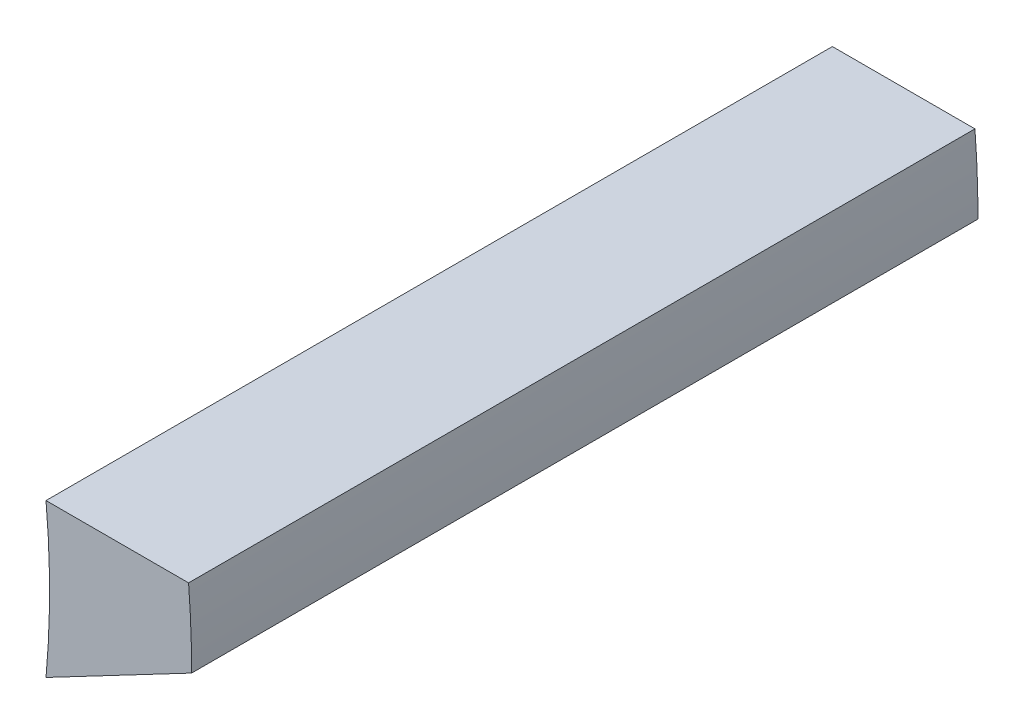
from build123d import *

# Parameters (mm, degrees)
EXTRUDE_1_DEPTH = 18


with BuildPart() as part:
    # 草图1 → 凸台-拉伸1 (new body)
    with BuildSketch(Plane.XY):
        with BuildLine():
            Line((18.711857444, 1.753621629), (21.975643768, 1.753621629))
            ThreePointArc((21.975643768, 1.753621629), (22.028029659, 0.877506244), (22.045500853, 0))
            Line((22.045500853, 0), (18.711857444, -1.753621629))
            ThreePointArc((18.711857444, -1.753621629), (18.79385, 0), (18.711857444, 1.753621629))
        make_face()
    extrude(amount=EXTRUDE_1_DEPTH)


solid = part.part
